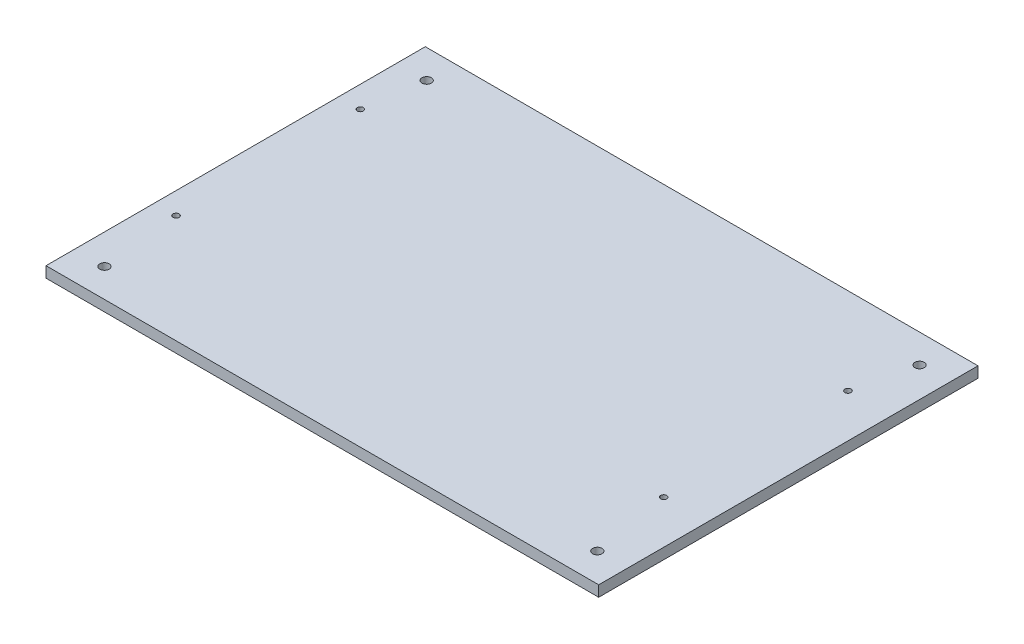
from build123d import *

# Parameters (mm, degrees)
SKETCH1_W                       = 323.85
SKETCH1_H                       = 222.25
BOSS_EXTRUDE1_DEPTH             = 3.175
M5_CLEARANCE_HOLE1_D            = 5.5
F_9_64_0_14063_DIAMETER_HOLE1_D = 3.572002


with BuildPart() as part:
    # Sketch1 → Boss-Extrude1 (new, symmetric)
    with BuildSketch(Plane(origin=(0, 0, 0), x_dir=(1, 0, 0), z_dir=(0, 1, 0))):
        Rectangle(SKETCH1_W, SKETCH1_H)
    extrude(amount=BOSS_EXTRUDE1_DEPTH, both=True)

    # M5 Clearance Hole1 (through all)
    with Locations(Plane(origin=(0, 3.175, 0), x_dir=(1, 0, 0), z_dir=(0, 1, 0))):
        with Locations((-144.399, 94.3991), (144.399, 94.3991), (144.399, -94.3991), (-144.399, -94.3991)):
            Hole(M5_CLEARANCE_HOLE1_D / 2)

    # 9/64 (0.14063) Diameter Hole1 (through all)
    with Locations(Plane(origin=(0, 3.175, 0), x_dir=(1, 0, 0), z_dir=(0, 1, 0))):
        with Locations((-149.225, 60.325), (-149.225, -47.625), (136.525, 60.325), (136.525, -47.625)):
            Hole(F_9_64_0_14063_DIAMETER_HOLE1_D / 2)


solid = part.part
